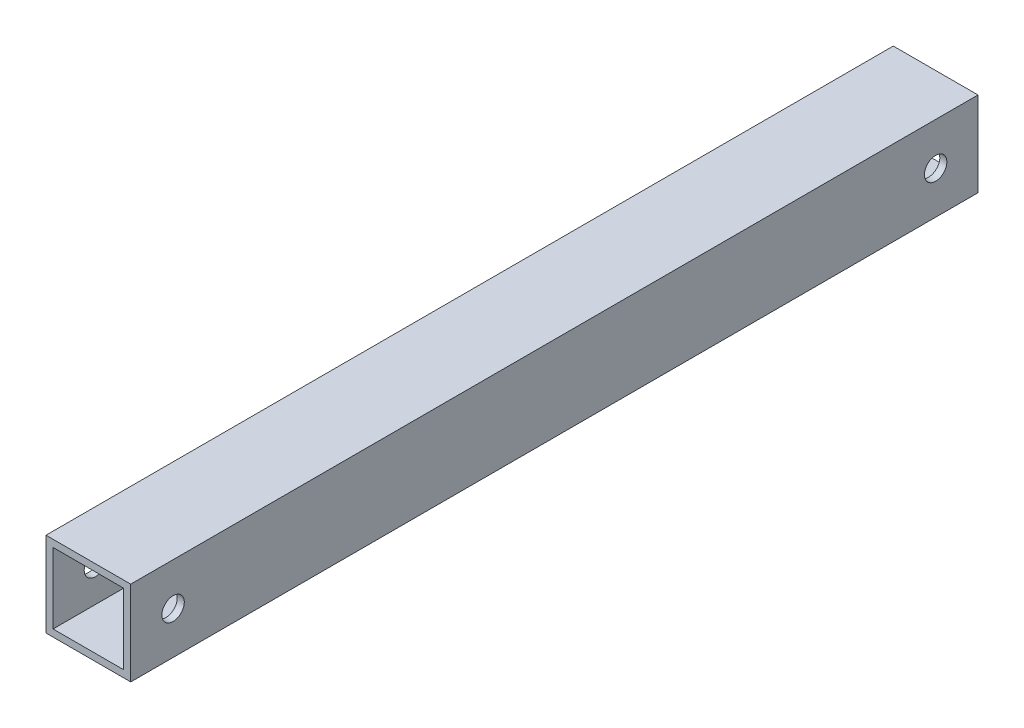
from build123d import *

# Parameters (mm, degrees)
SKETCH2_W                = 38.1
SKETCH2_H                = 38.1
SKETCH2_W_2              = 31.75
SKETCH2_H_2              = 31.75
BOSS_EXTRUDE1_DEPTH      = 381
X_0_397_DIAMETER_HOLE1_D = 10.0838


with BuildPart() as part:
    # Sketch2 → Boss-Extrude1 (new body)
    with BuildSketch(Plane.XY):
        with Locations((19.05, 19.05)):
            Rectangle(SKETCH2_W, SKETCH2_H)
        with Locations((19.05, 19.05)):
            Rectangle(SKETCH2_W_2, SKETCH2_H_2, mode=Mode.SUBTRACT)
    extrude(amount=BOSS_EXTRUDE1_DEPTH)

    # X (0.397) Diameter Hole1 (through all)
    with Locations(Plane.ZY):
        with Locations((19.05, 19.05), (361.95, 19.05)):
            Hole(X_0_397_DIAMETER_HOLE1_D / 2)


solid = part.part
